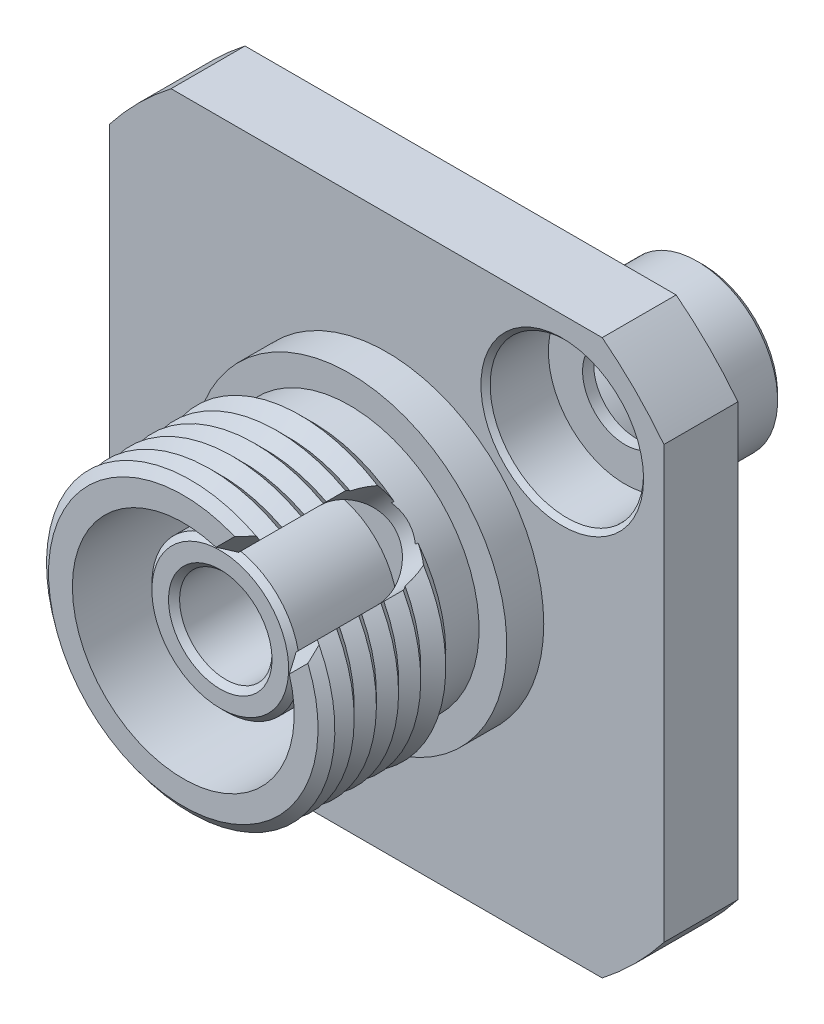
from build123d import *

# Parameters (mm, degrees)
ESQUISSE1_R                                = 3
BOSS_EXTRU_1_DEPTH                         = 2
CHAMBRAGE_POUR_VIS_T_TE_HEXAGONALE_2_COUNT = 2
CHAMBRAGE_POUR_VIS_T_TE_HEXAGONALE_2_PITCH = 13.435028843
CHAMBRAGE_POUR_VIS_T_TE_HEXAGONALE_3_COUNT = 2
CHAMBRAGE_POUR_VIS_T_TE_HEXAGONALE_3_PITCH = 6.717514421
ENL_V_MAT_EXTRU_1_DEPTH                    = 7.3
ESQUISSE10_R                               = 0.75
BOSS_EXTRU_2_DEPTH                         = 1
CONG_1_R                                   = 0.2


with BuildPart() as part:
    # Esquisse1 → Boss.-Extru.1 (new body)
    with BuildSketch(Plane.XY):
        with BuildLine():
            Line((-5.830951895, 7.5), (5.830951895, 7.5))
            ThreePointArc((5.830951895, 7.5), (6.717514421, 6.717514421), (7.5, 5.830951895))
            Line((7.5, 5.830951895), (7.5, -5.830951895))
            ThreePointArc((7.5, -5.830951895), (6.717514421, -6.717514421), (5.830951895, -7.5))
            Line((5.830951895, -7.5), (-5.830951895, -7.5))
            ThreePointArc((-5.830951895, -7.5), (-6.717514421, -6.717514421), (-7.5, -5.830951895))
            Line((-7.5, -5.830951895), (-7.5, 5.830951895))
            ThreePointArc((-7.5, 5.830951895), (-6.717514421, 6.717514421), (-5.830951895, 7.5))
        make_face()
        Circle(ESQUISSE1_R, mode=Mode.SUBTRACT)
    extrude(amount=BOSS_EXTRU_1_DEPTH)

    # Esquisse3 → Révolution1 (revolve)
    with BuildSketch(Plane(origin=(0, 0, 0), x_dir=(0, 0, -1), z_dir=(1, 0, 0)), mode=Mode.PRIVATE) as r_volution1_sk:
        Polygon((-7.5, 3.645251177), (-7.5, 3), (-3.7, 3), (-3.7, 2), (-6.35, 2), (-6.5, 1.85), (-6.5, 1.4), (-6.35, 1.25), (6.4, 1.25), (6.55, 1.4), (6.55, 2.025), (6.4, 2.175), (2.5, 2.175), (2.5, 2.85), (2.35, 3), (-2, 3), (-2, 4.25), (-3, 4.25), (-3, 3.5), (-4, 3.5), (-4, 3.6), (-4.338552793, 3.938552793), (-4.677105586, 3.6), (-4.977105586, 3.9), (-5.277105586, 3.6), (-5.577105586, 3.9), (-5.877105586, 3.6), (-6.177105586, 3.9), (-6.477105586, 3.6), (-6.777105586, 3.9), (-7.077105586, 3.6), (-7.3, 3.9), align=None)
    revolve(r_volution1_sk.sketch.rotate(Axis((0, 0, -5.875), (0, 0, 1)), 90), axis=Axis((0, 0, -5.875), (0, 0, 1)))

    # Esquisse6 → Chambrage pour vis à tête hexagonale M31 (revolve, cut)
    with BuildSketch(Plane(origin=(4.75, 4.75, 2), x_dir=(0, -1, 0), z_dir=(1, 0, 0))):
        Polygon((0, 0), (0, 8.55), (1.15, 8.55), (1.15, 1.7), (2.075, 1.7), (2.075, 0.125), (2.2, 0), align=None)
    chambrage_pour_vis_t_te_hexagonale_m31 = revolve(axis=Axis((4.75, 4.75, 8.35), (0, 0, -1)), mode=Mode.SUBTRACT)

    # Chambrage pour vis _ t_te hexagonale 2: Chambrage pour vis à tête hexagonale M31 ×2
    with Locations(*[Vector(-0.7071067811865475, -0.7071067811865477, 0) * (i * CHAMBRAGE_POUR_VIS_T_TE_HEXAGONALE_2_PITCH) for i in range(1, CHAMBRAGE_POUR_VIS_T_TE_HEXAGONALE_2_COUNT)]):
        add(chambrage_pour_vis_t_te_hexagonale_m31, mode=Mode.SUBTRACT)

    # Chambrage pour vis _ t_te hexagonale 3: Chambrage pour vis à tête hexagonale M31 ×2
    with Locations(*[Vector(-0.7071067811865475, -0.7071067811865477, 0) * (i * CHAMBRAGE_POUR_VIS_T_TE_HEXAGONALE_3_PITCH) for i in range(1, CHAMBRAGE_POUR_VIS_T_TE_HEXAGONALE_3_COUNT)]):
        add(chambrage_pour_vis_t_te_hexagonale_m31, mode=Mode.SUBTRACT)

    # Esquisse9 → Enlèv. mat.-Extru.1 (cut)
    with BuildSketch(Plane(origin=(6.665475947, 6.665475947, 0), x_dir=(-0.7071067811865462, 0.7071067811865488, 0), z_dir=(0.7071067811865488, 0.7071067811865462, 0))):
        with BuildLine():
            Line((1.1, 7.2), (1.1, 5))
            ThreePointArc((1.1, 5), (0, 3.9), (-1.1, 5))
            Line((-1.1, 5), (-1.1, 7.2))
            Line((-1.1, 7.2), (-2.12556829, 8.22556829))
            Line((-2.12556829, 8.22556829), (2.12556829, 8.22556829))
            Line((2.12556829, 8.22556829), (1.1, 7.2))
        make_face()
    extrude(amount=-ENL_V_MAT_EXTRU_1_DEPTH, mode=Mode.SUBTRACT)

    # Esquisse10 → Boss.-Extru.2 (add)
    with BuildSketch(Plane(origin=(0, 0, 0), x_dir=(-1, 0, 0), z_dir=(0, 0, -1))):
        with Locations(Location((0, 5.5, 0), (0, 0, 180))):
            Circle(ESQUISSE10_R)
    extrude(amount=BOSS_EXTRU_2_DEPTH)

    # Congé1
    cong_1_edges = [part.edges().sort_by_distance(p)[0] for p in [
        (-0.75, 5.5, -1),
    ]]
    fillet(cong_1_edges, radius=CONG_1_R)


solid = part.part
